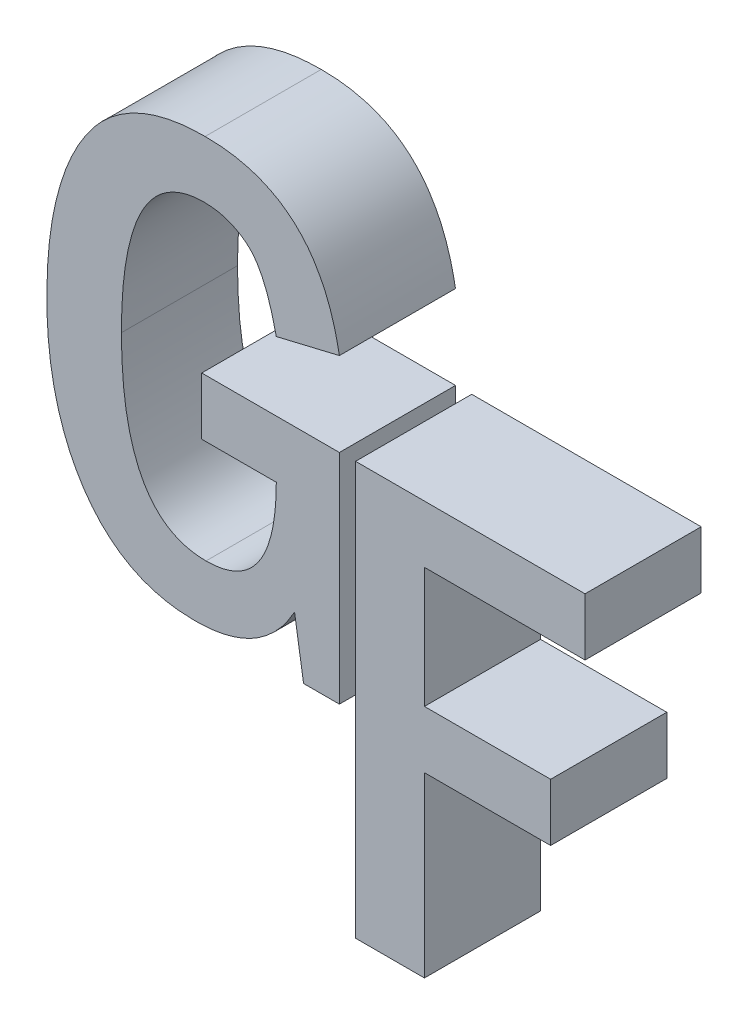
from build123d import *

# Parameters (mm, degrees)
BOSS_EXTRUDE1_DEPTH   = 5
BOSS_EXTRUDE1_2_DEPTH = 5


with BuildPart() as part:
    # Sketch1 → Boss-Extrude1 (new body)
    with BuildSketch(Plane.XY):
        with BuildLine():
            Line((-2.153470948, 29.646336052), (3.774849364, 29.646336052))
            Line((3.774849364, 29.646336052), (3.774849364, 20.25982889))
            Line((3.774849364, 20.25982889), (2.231015949, 20.25982889))
            Line((2.231015949, 20.25982889), (1.845057596, 22.729962354))
            add(Edge.make_bspline(
                [(1.845057596, 22.729962354), (1.729525903, 22.533304465), (1.503690818, 22.148888294), (1.080558094, 21.64563251), (0.614887351, 21.215397775), (0.098449936, 20.861989165), (-0.470978389, 20.59070171), (-1.089712716, 20.398862088), (-1.756542389, 20.280088735), (-2.217285213, 20.266714956), (-2.454518464, 20.25982889)],
                knots=[0, 0, 0, 0, 1.045094897, 2.042894806, 3.00396893, 3.947178755, 4.9030891, 5.887118072, 6.9120919, 8, 8, 8, 8], degree=3))
            add(Edge.make_bspline(
                [(-2.454518464, 20.25982889), (-2.698130672, 20.267113832), (-3.173876929, 20.281340473), (-3.865569565, 20.396116702), (-4.517165489, 20.580501886), (-5.128450967, 20.845286717), (-5.697036574, 21.186540071), (-6.225022821, 21.601219562), (-6.709406437, 22.092515395), (-7.15098965, 22.655095858), (-7.543326313, 23.282859382), (-7.88847734, 23.964362978), (-8.17649002, 24.702002757), (-8.415702521, 25.490301095), (-8.600828997, 26.332985286), (-8.729665047, 27.228220065), (-8.807362473, 28.177030046), (-8.8175854, 28.826667007), (-8.8228313, 29.160028526)],
                knots=[0, 0, 0, 0, 0.949721203, 1.854694852, 2.72662243, 3.585163148, 4.444876216, 5.306169425, 6.196783289, 7.129381836, 8.090003596, 9.07966204, 10.104665789, 11.174562855, 12.289781402, 13.466383582, 14.699873518, 16, 16, 16, 16], degree=3))
            add(Edge.make_bspline(
                [(-8.8228313, 29.160028526), (-8.817591801, 29.511394704), (-8.807387464, 30.195708017), (-8.729749384, 31.194594037), (-8.600883803, 32.137344421), (-8.41506872, 33.024328597), (-8.181037172, 33.855586008), (-7.896776275, 34.631630559), (-7.555402518, 35.349827452), (-7.16346701, 36.011365884), (-6.717945821, 36.608718924), (-6.212357575, 37.128925948), (-5.646749532, 37.564025711), (-5.026780123, 37.922760562), (-4.350603128, 38.201889817), (-3.61739057, 38.396570378), (-2.830467553, 38.519413614), (-2.286456936, 38.532228825), (-2.006806774, 38.53881652)],
                knots=[0, 0, 0, 0, 1.283507334, 2.49973165, 3.657598748, 4.757275942, 5.807648446, 6.809917029, 7.772764068, 8.708573029, 9.614724818, 10.488826572, 11.349943626, 12.213315118, 13.098354007, 14.013879131, 14.979029073, 16, 16, 16, 16], degree=3))
            add(Edge.make_bspline(
                [(-2.006806774, 38.53881652), (-1.809819511, 38.535508623), (-1.425112074, 38.529048445), (-0.864469996, 38.467256454), (-0.334854164, 38.360460256), (0.167928351, 38.222922542), (0.635266636, 38.028798301), (1.077673649, 37.807663901), (1.482767559, 37.532751211), (1.864512748, 37.224683434), (2.211085183, 36.870383281), (2.532802388, 36.479569395), (2.80885929, 36.038571734), (3.07395713, 35.56754015), (3.293545827, 35.0480383), (3.487617172, 34.489979216), (3.649367029, 33.889777833), (3.732263829, 33.473008126), (3.774849364, 33.258906242)],
                knots=[0, 0, 0, 0, 1.091721363, 2.132083677, 3.120913987, 4.084845068, 5.015843344, 5.921672224, 6.821642812, 7.723842905, 8.636607532, 9.564404469, 10.52381369, 11.516442864, 12.557758036, 13.644857496, 14.790122123, 16, 16, 16, 16], degree=3))
            Line((3.774849364, 33.258906242), (1.057702554, 32.610496208))
            add(Edge.make_bspline(
                [(1.057702554, 32.610496208), (1.017988506, 32.784541866), (0.942021599, 33.11746462), (0.810318891, 33.588658851), (0.673068245, 34.014139696), (0.519300746, 34.390094738), (0.358517036, 34.720067453), (0.188510465, 35.001815223), (0.007685514, 35.237165277), (-0.249559855, 35.481785215), (-0.599595416, 35.715739853), (-1.053009728, 35.921366653), (-1.543117531, 36.049375699), (-1.883815084, 36.062176697), (-2.05698136, 36.068683057)],
                knots=[0, 0, 0, 0, 1.250986768, 2.392946557, 3.427986007, 4.382396444, 5.237274797, 5.998106545, 6.685332127, 7.310289116, 8.478224255, 9.61622589, 10.788399614, 12, 12, 12, 12], degree=3))
            add(Edge.make_bspline(
                [(-2.05698136, 36.068683057), (-2.201420728, 36.06348151), (-2.482173943, 36.053371032), (-2.88941867, 35.97506005), (-3.267368794, 35.842647097), (-3.618144352, 35.659143032), (-3.942849997, 35.426227394), (-4.233923149, 35.133821934), (-4.500963596, 34.79390284), (-4.735285923, 34.39931385), (-4.945757205, 33.956931418), (-5.118712319, 33.459687093), (-5.276062166, 32.914350106), (-5.394404588, 32.314526456), (-5.497156277, 31.664803884), (-5.564409957, 30.96238493), (-5.601477087, 30.207670726), (-5.608187971, 29.6875475), (-5.611657797, 29.418620623)],
                knots=[0, 0, 0, 0, 0.822034536, 1.597825046, 2.350764774, 3.094526339, 3.844753019, 4.61655611, 5.435713419, 6.300036831, 7.224070609, 8.220419235, 9.294044468, 10.453410731, 11.698711865, 13.038421064, 14.468731767, 16, 16, 16, 16], degree=3))
            add(Edge.make_bspline(
                [(-5.611657797, 29.418620623), (-5.608661649, 29.148383698), (-5.602865204, 28.625574554), (-5.559380712, 27.867257416), (-5.493209044, 27.160938567), (-5.391682829, 26.506770655), (-5.26774952, 25.903676588), (-5.108619158, 25.353271445), (-4.925035604, 24.854286683), (-4.714228102, 24.406250115), (-4.469317297, 24.013479246), (-4.198298686, 23.670696762), (-3.900050103, 23.376452501), (-3.56889437, 23.139005258), (-3.208148239, 22.955263782), (-2.819700703, 22.823653617), (-2.402306839, 22.745532323), (-2.115209768, 22.735234846), (-1.968210939, 22.729962354)],
                knots=[0, 0, 0, 0, 1.52120012, 2.94296322, 4.274736016, 5.513118187, 6.667950076, 7.738394961, 8.735258225, 9.658498985, 10.520629887, 11.33501632, 12.113508884, 12.871241548, 13.619465388, 14.384432105, 15.172800375, 16, 16, 16, 16], degree=3))
            add(Edge.make_bspline(
                [(-1.968210939, 22.729962354), (-1.845878257, 22.734275072), (-1.607883105, 22.742665358), (-1.262237884, 22.790063864), (-0.942846742, 22.883006843), (-0.642381739, 22.998328917), (-0.371376572, 23.162517133), (-0.115938958, 23.349317682), (0.106330913, 23.581560706), (0.311130739, 23.842365285), (0.485650064, 24.141280533), (0.643661708, 24.471749854), (0.765807345, 24.840169648), (0.878029531, 25.239620688), (0.953647604, 25.675820047), (1.018500834, 26.145308167), (1.051002391, 26.649555044), (1.05542703, 26.997341353), (1.057702554, 27.176202588)],
                knots=[0, 0, 0, 0, 0.962390101, 1.872305717, 2.733866052, 3.573589864, 4.394267886, 5.217746971, 6.054724087, 6.912713418, 7.820094838, 8.770446228, 9.787838261, 10.867644684, 12.030373047, 13.265115176, 14.593490128, 16, 16, 16, 16], degree=3))
            Line((1.057702554, 27.176202588), (-2.153470948, 27.176202588))
            Line((-2.153470948, 27.176202588), (-2.153470948, 29.646336052))
        make_face()
    extrude(amount=-BOSS_EXTRUDE1_DEPTH)


with BuildPart() as body_2:
    # Sketch1 → Boss-Extrude1 2 (new body)
    with BuildSketch(Plane.XY):
        Polygon((4.471875445, 29.664871557), (14.352409299, 29.664871557), (14.352409299, 27.194738094), (7.436035601, 27.194738094), (7.436035601, 22.007457821), (12.870329221, 22.007457821), (12.870329221, 19.537324357), (7.436035601, 19.537324357), (7.436035601, 11.87991062), (4.471875445, 11.87991062), align=None)
    extrude(amount=-BOSS_EXTRUDE1_2_DEPTH)


solid = Compound([part.part, body_2.part])
